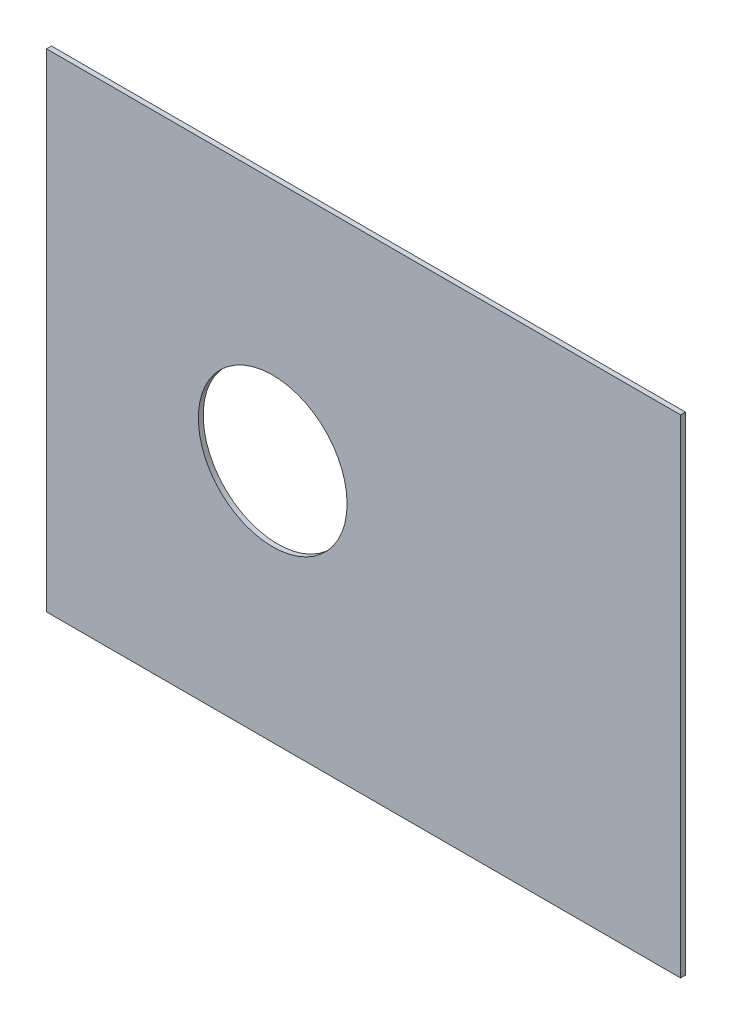
from build123d import *

# Parameters (mm, degrees)
SKETCH_1_W      = 260
SKETCH_1_H      = 200
SKETCH_1_R      = 30.5
EXTRUDE_1_DEPTH = 2


with BuildPart() as part:
    # Эскиз1 → Бобышка-Вытянуть1 (new body)
    with BuildSketch(Plane.XY):
        Rectangle(SKETCH_1_W, SKETCH_1_H)
        with Locations((-37.26, 0)):
            Circle(SKETCH_1_R, mode=Mode.SUBTRACT)
    extrude(amount=EXTRUDE_1_DEPTH)


solid = part.part
